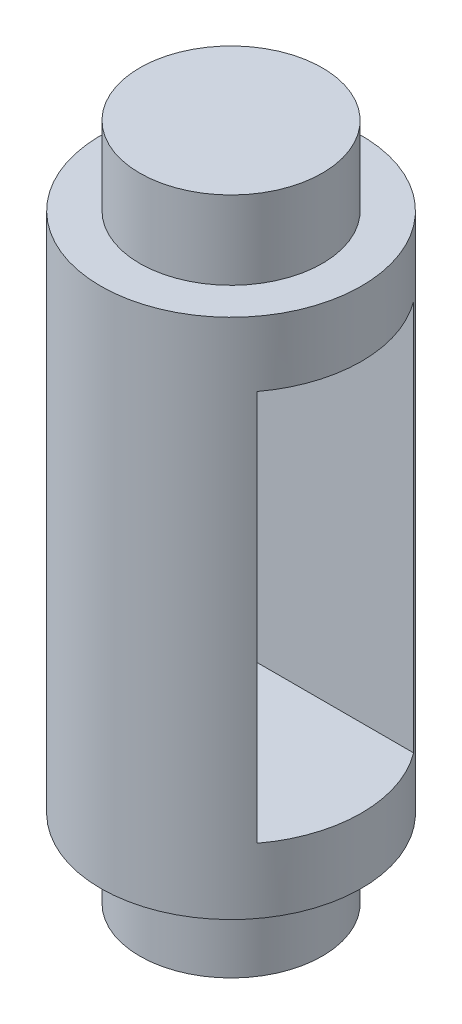
from build123d import *

# Parameters (mm, degrees)
CROQUIS1_R                 = 3.5
SALIENTE_EXTRUIR1_DEPTH    = 3
CROQUIS2_R                 = 5
SALIENTE_EXTRUIR2_DEPTH    = 20
CROQUIS3_R                 = 3.5
SALIENTE_EXTRUIR3_DEPTH    = 3
CORTAR_EXTRUIR1_DEPTH      = 10
CORTAR_EXTRUIR1_DEPTH_BACK = 11
CROQUIS4_W                 = 6
CROQUIS4_H                 = 15


with BuildPart() as part:
    # Croquis1 → Saliente-Extruir1 (new body)
    with BuildSketch(Plane(origin=(0, 0, 0), x_dir=(1, 0, 0), z_dir=(0, 1, 0))):
        with Locations(Location((0, 0, 0), (0, 0, 270))):
            Circle(CROQUIS1_R)
    extrude(amount=SALIENTE_EXTRUIR1_DEPTH)

    # Croquis2 → Saliente-Extruir2 (add)
    with BuildSketch(Plane(origin=(0, 3, 0), x_dir=(1, 0, 0), z_dir=(0, 1, 0))):
        with Locations(Location((0, 0, 0), (0, 0, 270))):
            Circle(CROQUIS2_R)
    extrude(amount=SALIENTE_EXTRUIR2_DEPTH)

    # Croquis3 → Saliente-Extruir3 (add)
    with BuildSketch(Plane(origin=(0, 23, 0), x_dir=(1, 0, 0), z_dir=(0, 1, 0))):
        with Locations(Location((0, 0, 0), (0, 0, 270))):
            Circle(CROQUIS3_R)
    extrude(amount=SALIENTE_EXTRUIR3_DEPTH)

    # Croquis4 → Cortar-Extruir1 (cut, two sides: drawn at the far end of the back side and taken through both)
    with BuildSketch(Plane(origin=(0, 0, 0), x_dir=(0, 0, -1), z_dir=(1, 0, 0)).offset(-CORTAR_EXTRUIR1_DEPTH_BACK)):
        with Locations((0, 13)):
            Rectangle(CROQUIS4_W, CROQUIS4_H)
    extrude(amount=CORTAR_EXTRUIR1_DEPTH + CORTAR_EXTRUIR1_DEPTH_BACK, mode=Mode.SUBTRACT)


solid = part.part
